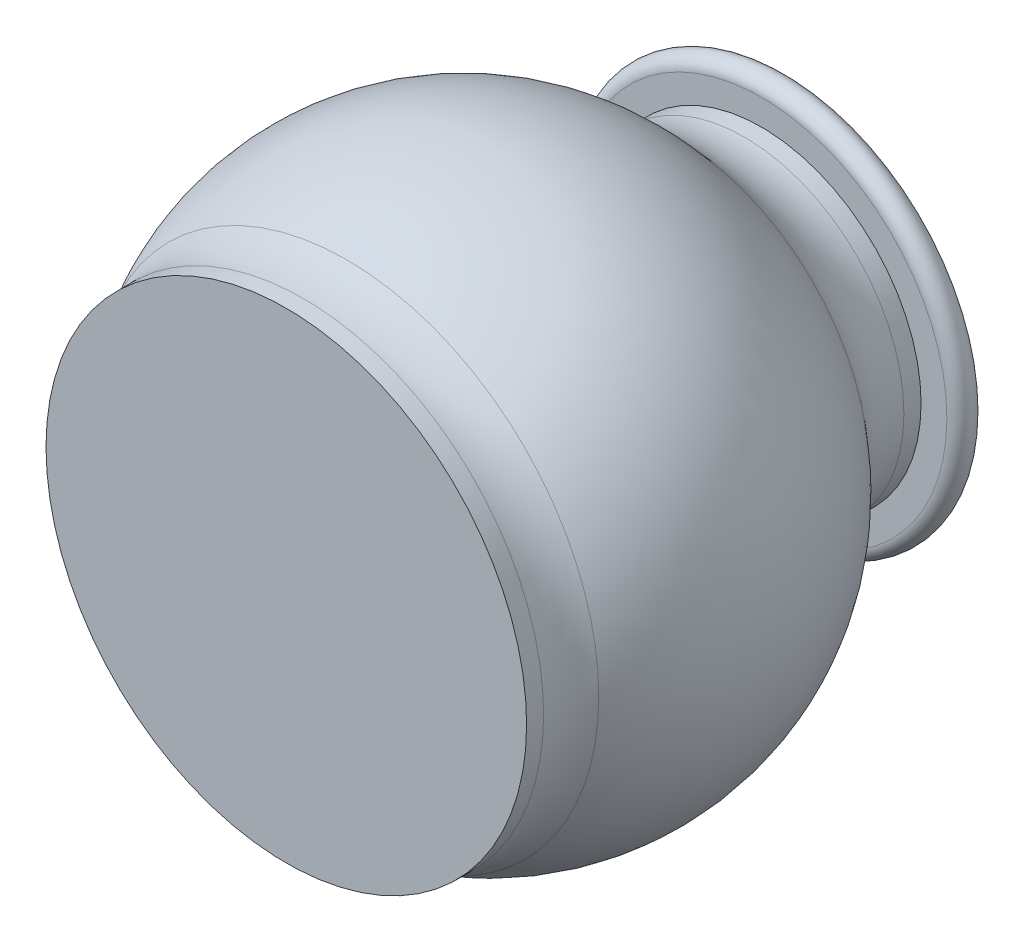
from build123d import *


with BuildPart() as part:
    # Sketch1 → Revolve1 (revolve)
    with BuildSketch(Plane(origin=(0, 0, 0), x_dir=(1, 0, 0), z_dir=(0, 1, 0)), mode=Mode.PRIVATE) as revolve1_sk:
        with BuildLine():
            Line((0, 0), (-27.959850053, 0))
            Line((-27.959850053, 0), (-27.959850053, 1.979075613))
            ThreePointArc((-27.959850053, 1.979075613), (-28.307836675, 4.594154531), (-29.327577602, 7.027230953))
            ThreePointArc((-29.327577602, 7.027230953), (-32.941787462, 27.566071163), (-22.295401019, 45.49819111))
            ThreePointArc((-22.295401019, 45.49819111), (-19.5591441, 48.965681257), (-18.583614608, 53.273689155))
            Line((-18.583614608, 53.273689155), (-18.583614608, 55.273689155))
            Line((-18.583614608, 55.273689155), (-21.583614608, 55.273689155))
            ThreePointArc((-21.583614608, 55.273689155), (-23.083614608, 56.773689155), (-21.583614608, 58.273689155))
            Line((-21.583614608, 58.273689155), (-15.583614608, 58.273689155))
            Line((-15.583614608, 58.273689155), (-15.583614608, 53.273689155))
            ThreePointArc((-15.583614608, 53.273689155), (-16.851802948, 47.673278887), (-20.408936942, 43.165541696))
            ThreePointArc((-20.408936942, 43.165541696), (-29.990684741, 27.026633744), (-26.737895867, 8.541677555))
            ThreePointArc((-26.737895867, 8.541677555), (-25.555517681, 5.869131963), (-25, 3))
            Line((-25, 3), (0, 3))
            Line((0, 3), (0, 0))
        make_face()
    revolve(revolve1_sk.sketch.rotate(Axis((0, 0, 0), (0, 0, -1)), 180), axis=Axis((0, 0, 0), (0, 0, -1)))


solid = part.part
